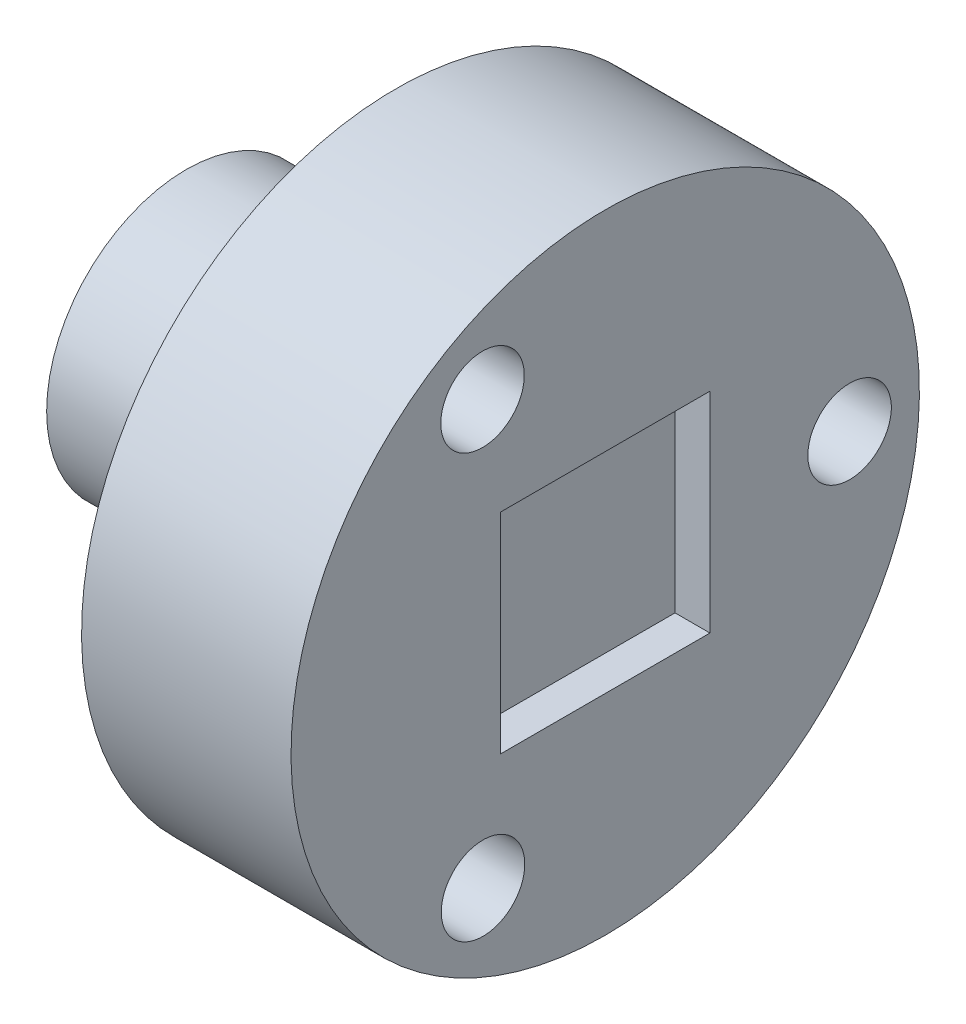
from build123d import *

# Parameters (mm, degrees)
SKETCH4_W                       = 9.525
SKETCH4_H                       = 9.525
CUT_EXTRUDE1_DEPTH              = 1.5875
FILLET1_R                       = 1.5875
F_6_CLEARANCE_HOLE1_D           = 3.7973
F_6_CLEARANCE_HOLE1_CSINK_D     = 5.0673
F_6_CLEARANCE_HOLE1_CSINK_ANGLE = 90


with BuildPart() as part:
    # Sketch3 → Revolve1 (revolve)
    with BuildSketch(Plane.XY):
        Polygon((-19.05, 0), (0, 0), (0, 14.2875), (-9.525, 14.2875), (-9.525, 6.35), (-19.05, 6.35), (-19.05, 4.1148), (-12.7, 4.1148), (-12.7, 3.175), (-19.05, 3.175), align=None)
    revolve(axis=Axis((-35.206134047, 0, 0), (1, 0, 0)))

    # Sketch4 → Cut-Extrude1 (cut)
    with BuildSketch(Plane(origin=(0, 0, 0), x_dir=(0, 0, -1), z_dir=(1, 0, 0))):
        Rectangle(SKETCH4_W, SKETCH4_H)
    extrude(amount=-CUT_EXTRUDE1_DEPTH, mode=Mode.SUBTRACT)

    # Fillet1
    fillet1_edges = [part.edges().sort_by_distance(p)[0] for p in [
        (-9.525, -6.35, 0),
    ]]
    fillet(fillet1_edges, radius=FILLET1_R)

    # #6 Clearance Hole1 (through all)
    with Locations(Plane.ZY.offset(9.525)):
        with Locations((-11.1125, 0), (5.577986509, 9.611124947), (5.556221618, -9.648822845)):
            CounterSinkHole(F_6_CLEARANCE_HOLE1_D / 2, F_6_CLEARANCE_HOLE1_CSINK_D / 2, counter_sink_angle=F_6_CLEARANCE_HOLE1_CSINK_ANGLE)


solid = part.part
